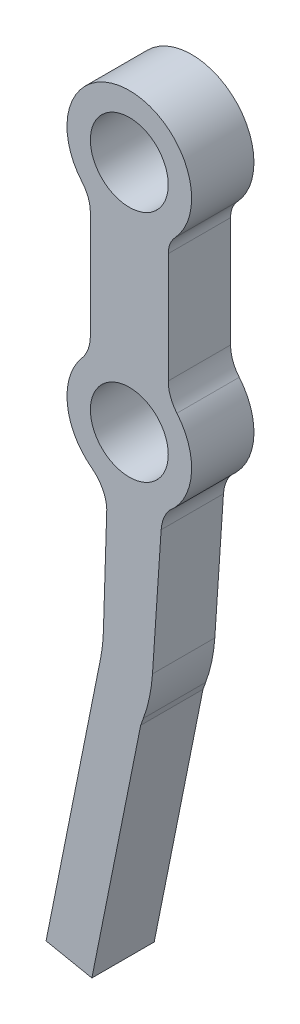
from build123d import *

# Parameters (mm, degrees)
SKETCH_1_R      = 2.5
EXTRUDE_1_DEPTH = 4


with BuildPart() as part:
    # 草图1 → 凸台-拉伸1 (new body)
    with BuildSketch(Plane.XY):
        with BuildLine():
            Line((1.48766526, -12.45557816), (2.043160586, -4.166239224))
            ThreePointArc((2.043160586, -4.166239224), (2.195630301, -3.470719779), (2.545454545, -2.850544554))
            ThreePointArc((2.545454545, -2.850544554), (3.98389954, -0.123518663), (3.05546146, 2.81651483))
            ThreePointArc((3.05546146, 2.81651483), (2.643225677, 3.526362386), (2.5, 4.334637277))
            Line((2.5, 4.334637277), (2.5, 11.411754756))
            ThreePointArc((2.5, 11.411754756), (2.612083111, 12.004318679), (2.932846289, 12.515009985))
            ThreePointArc((2.932846289, 12.515009985), (0.073861123, 19.234330318), (-3.03128037, 12.625158038))
            ThreePointArc((-3.03128037, 12.625158038), (-2.637104468, 11.957199077), (-2.5, 11.19382094))
            Line((-2.5, 11.19382094), (-2.5, 4.337916945))
            ThreePointArc((-2.5, 4.337916945), (-2.643562436, 3.527132911), (-3.056792932, 2.814938078))
            ThreePointArc((-3.056792932, 2.814938078), (-3.974554812, -0.215447508), (-2.401879608, -2.963577121))
            ThreePointArc((-2.401879608, -2.963577121), (-1.721128393, -3.761289924), (-1.445511633, -4.773121596))
            Line((-1.445511633, -4.773121596), (-1.663239971, -11.663933953))
            ThreePointArc((-1.663239971, -11.663933953), (-1.724028802, -12.493204072), (-1.853501284, -13.314557278))
            Line((-1.853501284, -13.314557278), (-5.343304788, -30.714907241))
            Line((-5.343304788, -30.714907241), (-2.401879608, -31.304837669))
            Line((-2.401879608, -31.304837669), (0.728861428, -15.694792688))
            Line((0.728861428, -15.694792688), (0.903082999, -15.217807594))
            ThreePointArc((0.903082999, -15.217807594), (1.293351086, -13.857428153), (1.48766526, -12.45557816))
        make_face()
        with Locations((0, 0.235012309)):
            Circle(SKETCH_1_R, mode=Mode.SUBTRACT)
        with Locations((0, 15.235012309)):
            Circle(SKETCH_1_R, mode=Mode.SUBTRACT)
    extrude(amount=EXTRUDE_1_DEPTH)


solid = part.part
